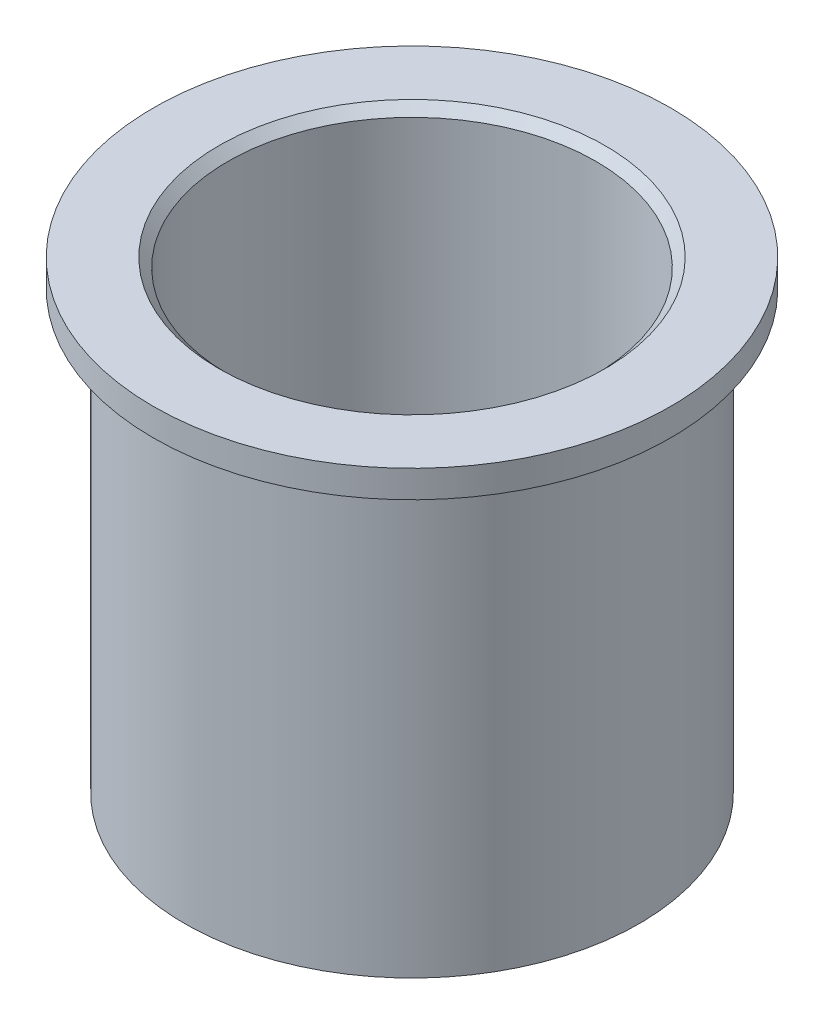
from build123d import *

# Parameters (mm, degrees)
SKETCH1_R           = 12.7
SKETCH1_R_2         = 10.287
BOSS_EXTRUDE1_DEPTH = 24.384
SKETCH2_R           = 14.4526
SKETCH2_R_2         = 10.287
BOSS_EXTRUDE2_DEPTH = 1.524
CHAMFER1_SIZE       = 0.508


with BuildPart() as part:
    # Sketch1 → Boss-Extrude1 (new body)
    with BuildSketch(Plane(origin=(0, 0, 0), x_dir=(1, 0, 0), z_dir=(0, 1, 0))):
        with Locations(Location((0, 0, 0), (0, 0, 90))):
            Circle(SKETCH1_R)
        with Locations(Location((0, 0, 0), (0, 0, 90))):
            Circle(SKETCH1_R_2, mode=Mode.SUBTRACT)
    extrude(amount=BOSS_EXTRUDE1_DEPTH)

    # Sketch2 → Boss-Extrude2 (add)
    with BuildSketch(Plane(origin=(0, 24.384, 0), x_dir=(1, 0, 0), z_dir=(0, 1, 0))):
        with Locations(Location((0, 0, 0), (0, 0, 90))):
            Circle(SKETCH2_R)
        with Locations(Location((0, 0, 0), (0, 0, 90))):
            Circle(SKETCH2_R_2, mode=Mode.SUBTRACT)
    extrude(amount=BOSS_EXTRUDE2_DEPTH)

    # Chamfer1
    chamfer1_edges = [part.edges().sort_by_distance(p)[0] for p in [
        (0, 25.908, 10.287),
        (0, 0, 10.287),
    ]]
    chamfer(chamfer1_edges, length=CHAMFER1_SIZE)


solid = part.part
